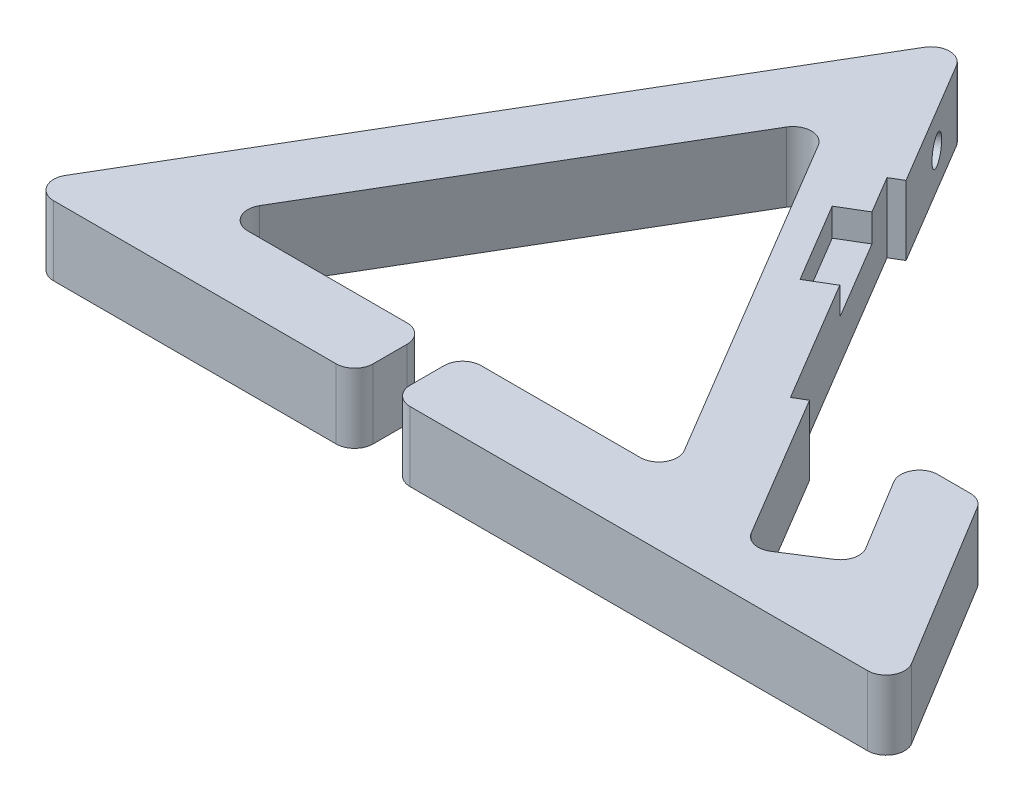
from build123d import *

# Parameters (mm, degrees)
BOSS_EXTRUDE1_DEPTH = 7.5
SKETCH2_R           = 1.5
CUT_EXTRUDE1_DEPTH  = 9
CUT_EXTRUDE4_DEPTH  = 7
SKETCH6_R           = 1.25
BOSS_EXTRUDE2_DEPTH = 2
FILLET1_R           = 1
CUT_EXTRUDE5_DEPTH  = 3
SKETCH8_W           = 30
SKETCH8_H           = 7.5
CUT_EXTRUDE6_DEPTH  = 1.5


with BuildPart() as part:
    # Sketch1 → Boss-Extrude1 (new body)
    with BuildSketch(Plane(origin=(0, 0, 0), x_dir=(1, 0, 0), z_dir=(0, 1, 0))):
        with BuildLine():
            Line((0.6, -4.416738673), (-25.816064279, -4.416738673))
            ThreePointArc((-25.816064279, -4.416738673), (-27.230277841, -3.830952235), (-27.816064279, -2.416738673))
            Line((-27.816064279, -2.416738673), (-27.816064279, 1.242047676))
            ThreePointArc((-27.816064279, 1.242047676), (-27.230277841, 2.656261238), (-25.816064279, 3.242047676))
            Line((-25.816064279, 3.242047676), (-8.616701404, 3.242047676))
            ThreePointArc((-8.616701404, 3.242047676), (-6.877923642, 4.253790678), (-6.898342112, 6.265395781))
            Line((-6.898342112, 6.265395781), (-28.209840808, 42.050688808))
            ThreePointArc((-28.209840808, 42.050688808), (-29.932839186, 43.027335323), (-31.651288288, 42.042706201))
            Line((-31.651288288, 42.042706201), (-52.738515342, 6.257413174))
            ThreePointArc((-52.738515342, 6.257413174), (-52.751907933, 4.249760166), (-51.015427154, 3.242047676))
            Line((-51.015427154, 3.242047676), (-33.816064279, 3.242047676))
            ThreePointArc((-33.816064279, 3.242047676), (-32.401850716, 2.656261238), (-31.816064279, 1.242047676))
            Line((-31.816064279, 1.242047676), (-31.816064279, -2.416738673))
            ThreePointArc((-31.816064279, -2.416738673), (-32.401850716, -3.830952235), (-33.816064279, -4.416738673))
            Line((-33.816064279, -4.416738673), (-64.322377342, -4.416738673))
            ThreePointArc((-64.322377342, -4.416738673), (-66.058858122, -3.409026183), (-66.045465531, -1.401373175))
            Line((-66.045465531, -1.401373175), (-31.651288288, 56.965983893))
            ThreePointArc((-31.651288288, 56.965983893), (-29.932839186, 57.950613015), (-28.209840808, 56.973966501))
            Line((-28.209840808, 56.973966501), (4.418617661, 2.185752684))
            ThreePointArc((4.418617661, 2.185752684), (5.677744474, 1.262538298), (7.216741926, 1.52561999))
            Line((7.216741926, 1.52561999), (11.407599177, 4.21358701))
            ThreePointArc((11.407599177, 4.21358701), (12.276616363, 5.447347792), (12.036115602, 6.93715178))
            Line((12.036115602, 6.93715178), (7.323304576, 14.677687772))
            ThreePointArc((7.323304576, 14.677687772), (7.288002317, 16.697524788), (9.031585974, 17.717771743))
            Line((9.031585974, 17.717771743), (12.543887874, 17.717771743))
            ThreePointArc((12.543887874, 17.717771743), (13.523640919, 17.4613554), (14.252169272, 16.757855713))
            Line((14.252169272, 16.757855713), (25.293332405, -1.376654703))
            ThreePointArc((25.293332405, -1.376654703), (25.328634664, -3.396491718), (23.585051007, -4.416738673))
            Line((23.585051007, -4.416738673), (0.6, -4.416738673))
        make_face()
    extrude(amount=BOSS_EXTRUDE1_DEPTH)

    # Sketch2 → Cut-Extrude1 (cut)
    with BuildSketch(Plane(origin=(4.222678331, 0, -2.514765037), x_dir=(-0.5116740525225859, 0, -0.8591796459269238), z_dir=(0.8591796459269239, 0, -0.5116740525225859))):
        with Locations((57.281755723, 3.75)):
            Circle(SKETCH2_R)
    extrude(amount=-CUT_EXTRUDE1_DEPTH, mode=Mode.SUBTRACT)

    # Sketch5 → Cut-Extrude4 (cut)
    with BuildSketch(Plane(origin=(3.363498685, 0, -2.003090985), x_dir=(-0.5116740525225859, 0, -0.8591796459269238), z_dir=(0.8591796459269239, 0, -0.5116740525225859))):
        with BuildLine():
            ThreePointArc((59.687787147, 1.923672452), (60.293645506, 3.69481399), (59.625444471, 5.443388859))
            ThreePointArc((59.625444471, 5.443388859), (59.11581554, 5.480697337), (59.078507063, 4.971068407))
            ThreePointArc((59.078507063, 4.971068407), (59.57110599, 3.68201607), (59.124466188, 2.376327548))
            ThreePointArc((59.124466188, 2.376327548), (59.179799119, 1.868339521), (59.687787147, 1.923672452))
        make_face()
        with BuildLine():
            ThreePointArc((54.875724299, 1.923672452), (54.26986594, 3.69481399), (54.938066975, 5.443388859))
            ThreePointArc((54.938066975, 5.443388859), (55.447695906, 5.480697337), (55.485004384, 4.971068407))
            ThreePointArc((55.485004384, 4.971068407), (54.992405456, 3.68201607), (55.439045258, 2.376327548))
            ThreePointArc((55.439045258, 2.376327548), (55.383712327, 1.868339521), (54.875724299, 1.923672452))
        make_face()
    extrude(amount=-CUT_EXTRUDE4_DEPTH, mode=Mode.SUBTRACT)

    # Sketch6 → Boss-Extrude2 (add)
    with BuildSketch(Plane(origin=(11.862431053, 0, -7.222419211), x_dir=(0.5200419851467809, 0, 0.8541406989978848), z_dir=(-0.8541406989978848, 0, 0.5200419851467809))):
        with Locations(Location((-1.021383997, 3.75, 0), (0, 0, 180))):
            Circle(SKETCH6_R)
    extrude(amount=BOSS_EXTRUDE2_DEPTH)

    # Fillet1
    fillet1_edges = [part.edges().sort_by_distance(p)[0] for p in [
        (10.273039575, 3.75, -5.987065009),
    ]]
    fillet(fillet1_edges, radius=FILLET1_R)

    # Sketch7 → Cut-Extrude5 (cut)
    with BuildSketch(Plane.XZ.offset(-7.5)):
        Polygon((-17.79728073, -39.489672278), (-21.775246759, -37.120642694), (-16.658506234, -28.528846235), (-12.680540205, -30.897875819), align=None)
    extrude(amount=CUT_EXTRUDE5_DEPTH, mode=Mode.SUBTRACT)

    # Sketch8 → Cut-Extrude6 (cut)
    with BuildSketch(Plane(origin=(4.222678331, 0, -2.514765037), x_dir=(-0.5116740525225859, 0, -0.8591796459269238), z_dir=(0.8591796459269239, 0, -0.5116740525225859))):
        with Locations((32.718162055, 3.75)):
            Rectangle(SKETCH8_W, SKETCH8_H)
    extrude(amount=-CUT_EXTRUDE6_DEPTH, mode=Mode.SUBTRACT)


solid = part.part
